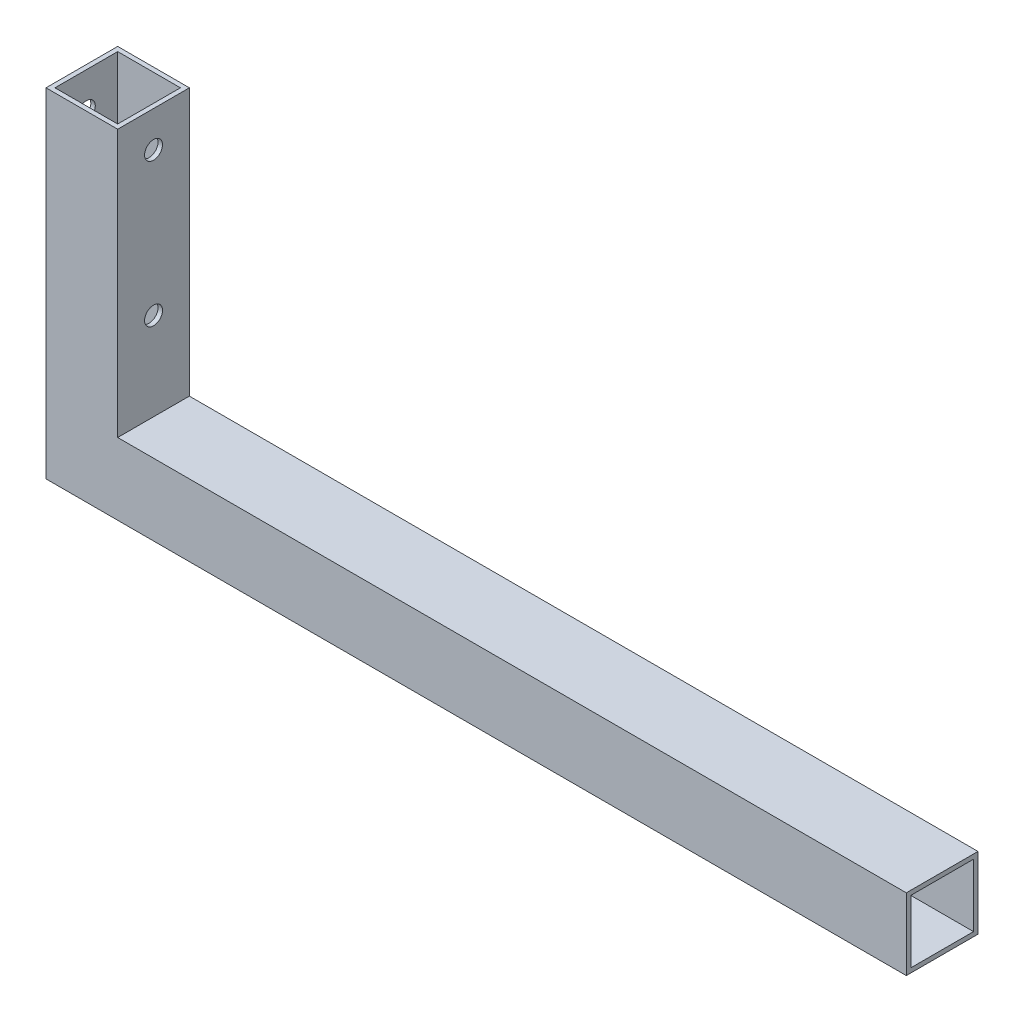
from build123d import *

# Parameters (mm, degrees)
SKETCH1_W                       = 25.4
SKETCH1_H                       = 25.4
SKETCH1_W_2                     = 22.225
SKETCH1_H_2                     = 22.225
BOSS_EXTRUDE1_DEPTH             = 228.6
SKETCH2_R                       = 3.175
CUT_EXTRUDE1_DEPTH              = 231.35713577
SKETCH3_R                       = 3.175
CUT_EXTRUDE2_DEPTH              = 231.35713577
CUT_EXTRUDE3_DEPTH              = 231.35713577
SKETCH6_W                       = 25.4
SKETCH6_H                       = 25.4
SKETCH6_W_2                     = 22.225
SKETCH6_H_2                     = 22.225
BOSS_EXTRUDE3_DEPTH             = 279.4
BOSS_EXTRUDE3_DIRECTION_2_REACH = 232.357


with BuildPart() as part:
    # Sketch1 → Boss-Extrude1 (new body)
    with BuildSketch(Plane(origin=(0, 0, 0), x_dir=(1, 0, 0), z_dir=(0, 1, 0))):
        Rectangle(SKETCH1_W, SKETCH1_H)
        Rectangle(SKETCH1_W_2, SKETCH1_H_2, mode=Mode.SUBTRACT)
    extrude(amount=BOSS_EXTRUDE1_DEPTH)

    # Sketch2 → Cut-Extrude1 (cut, through all)
    with BuildSketch(Plane(origin=(12.7, 0, 0), x_dir=(0, 0, -1), z_dir=(1, 0, 0))):
        with Locations((0, 215.9)):
            Circle(SKETCH2_R)
        with Locations((0, 165.1)):
            Circle(SKETCH2_R)
    extrude(amount=-CUT_EXTRUDE1_DEPTH, mode=Mode.SUBTRACT)

    # Sketch3 → Cut-Extrude2 (cut, through all)
    with BuildSketch(Plane.XY.offset(12.7)):
        with Locations((0, 69.85)):
            Circle(SKETCH3_R)
        with Locations((0, 19.05)):
            Circle(SKETCH3_R)
    extrude(amount=-CUT_EXTRUDE2_DEPTH, mode=Mode.SUBTRACT)

    # Sketch4 → Cut-Extrude3 (cut, through all)
    with BuildSketch(Plane.XY.offset(12.7)):
        Polygon((-12.7, 0), (-12.7, 108.6), (12.7, 134), (12.7, 0), align=None)
    extrude(amount=-CUT_EXTRUDE3_DEPTH, mode=Mode.SUBTRACT)

    # Sketch6 → Boss-Extrude3 (add)
    with BuildSketch(Plane(origin=(12.7, 0, 0), x_dir=(0, 0, -1), z_dir=(1, 0, 0))):
        with Locations((0, 121.3)):
            Rectangle(SKETCH6_W, SKETCH6_H)
        with Locations((0, 121.3)):
            Rectangle(SKETCH6_W_2, SKETCH6_H_2, mode=Mode.SUBTRACT)
    extrude(amount=BOSS_EXTRUDE3_DEPTH)

    # Sketch6 → Boss-Extrude3 direction 2 (add, up to next)
    with BuildSketch(Plane(origin=(12.7, 0, 0), x_dir=(0, 0, -1), z_dir=(1, 0, 0)), mode=Mode.PRIVATE) as boss_extrude3_direction_2_sk1:
        with Locations((0, 121.3)):
            Rectangle(SKETCH6_W, SKETCH6_H)
        with Locations((0, 121.3)):
            Rectangle(SKETCH6_W_2, SKETCH6_H_2, mode=Mode.SUBTRACT)
    boss_extrude3_direction_2_tool1 = extrude(boss_extrude3_direction_2_sk1.sketch, amount=-BOSS_EXTRUDE3_DIRECTION_2_REACH, mode=Mode.PRIVATE) - part.part
    add(boss_extrude3_direction_2_tool1.solids().sort_by_distance((12.7, 121.3, 12.34079))[0])


solid = part.part
